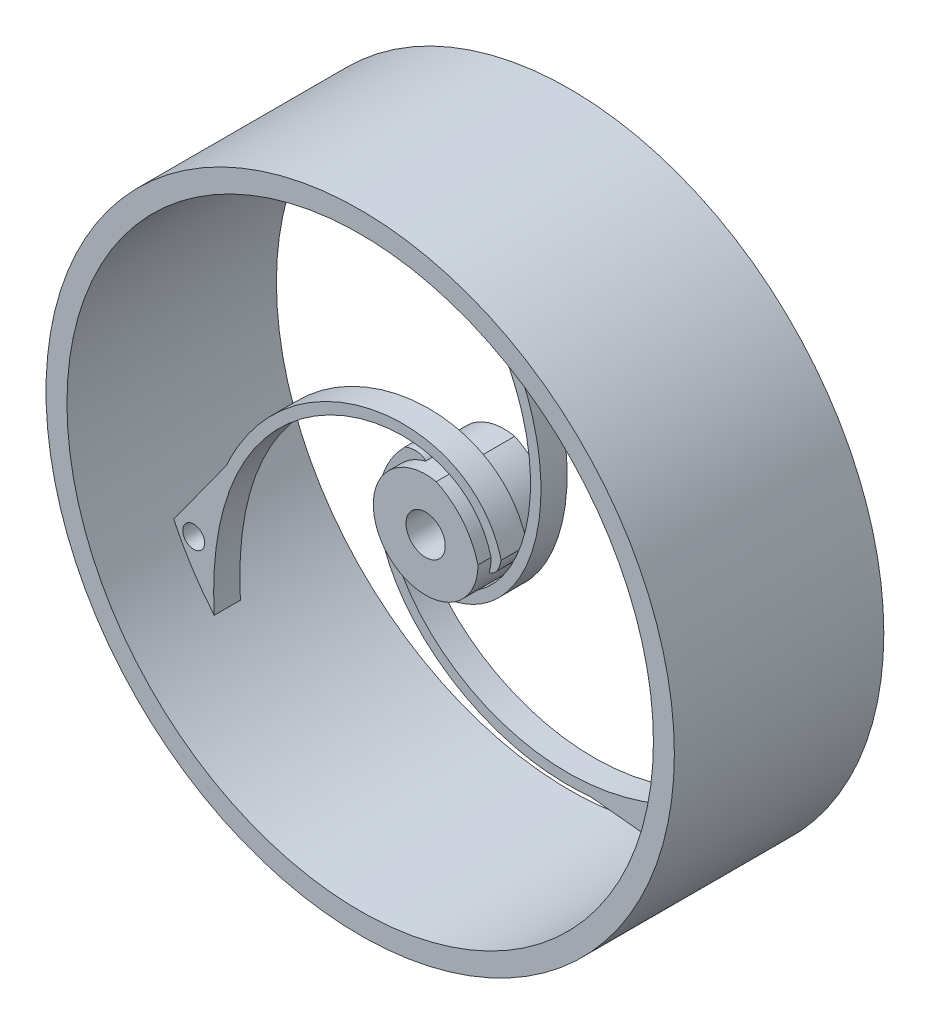
from build123d import *

# Parameters (mm, degrees)
SKETCH1_R            = 76.2
BOSS_EXTRUDE8_DEPTH  = 25.4
SKETCH1_3_R          = 2.652133243
BOSS_EXTRUDE9_DEPTH  = 6.35
SKETCH1_4_R          = 4.7625
BOSS_EXTRUDE10_DEPTH = 9.525
CIRPATTERN2_COUNT    = 3


with BuildPart() as part:
    # Sketch1 → Boss-Extrude8 (new, symmetric)
    with BuildSketch(Plane.XY):
        Circle(SKETCH1_R)
        with BuildLine():
            ThreePointArc((-64.2646615, -30.464859794), (-15.613322422, 69.385002435), (71.12, 0))
            ThreePointArc((71.12, 0), (24.341278866, -66.824819814), (-54.458080516, -45.74245147))
            ThreePointArc((-54.458080516, -45.74245147), (-55.813104666, -44.078926343), (-57.117332526, -42.375284367))
            ThreePointArc((-57.117332526, -42.375284367), (-60.982470201, -36.594982282), (-64.2646615, -30.464859794))
        make_face(mode=Mode.SUBTRACT)
    extrude(amount=BOSS_EXTRUDE8_DEPTH, both=True)

    # Sketch1<3> → Boss-Extrude9 (add)
    with BuildSketch(Plane.XY):
        with BuildLine():
            Line((-51.489686485, -12.770329882), (-64.2646615, -30.464859794))
            ThreePointArc((-64.2646615, -30.464859794), (-59.850844353, -38.417845205), (-54.458080516, -45.74245147))
            add(Edge.make_bspline(
                [(-54.458080516, -45.74245147), (-56.227173503, -12.770464941), (-42.479312579, 17.840425436), (5.439933994, 27.701840724), (12.7, 0)],
                knots=[0.164688389, 0.164688389, 0.164688389, 0.164688389, 0.164688389, 1.164688389, 1.164688389, 1.164688389, 1.164688389, 1.164688389], degree=4))
            ThreePointArc((12.7, 0), (12.581598046, -1.730141787), (12.228599905, -3.42802339))
            add(Edge.make_bspline(
                [(15.157020591, 0.643933082), (14.443060628, -2.918429068), (12.228599905, -3.42802339)],
                knots=[0, 0, 0, 0.719883781, 0.719883781, 0.719883781], degree=2))
            add(Edge.make_bspline(
                [(15.157020591, 0.643933082), (14.991425957, 1.275783561), (14.604911637, 2.54097033), (13.667954828, 4.887393309), (12.183192976, 7.556706342), (9.969654094, 10.294956422), (6.534622803, 13.326938907), (1.520056493, 15.963955949), (-5.168911286, 17.446899809), (-12.189081027, 17.436980233), (-21.635438647, 15.634364862), (-33.013454155, 10.343487809), (-43.696960831, 0.683796899), (-49.136108914, -7.765497225), (-51.219142397, -12.1715848), (-51.489686485, -12.770329882)],
                knots=[0, 0, 0, 0, 0.015625, 0.03125, 0.0625, 0.09375, 0.125, 0.1875, 0.25, 0.3125, 0.375, 0.5, 0.625, 0.725480641, 0.741105641, 0.741105641, 0.741105641, 0.741105641], degree=3))
        make_face()
        with Locations((-59.434967194, -31.713129844)):
            Circle(SKETCH1_3_R, mode=Mode.SUBTRACT)
    boss_extrude9 = extrude(amount=BOSS_EXTRUDE9_DEPTH)

    # Sketch1<4> → Boss-Extrude10 (add, symmetric)
    with BuildSketch(Plane.XY):
        with BuildLine():
            add(Edge.make_bspline(
                [(12.7, 0), (11.504351428, 4.56217151), (9.205933773, 8.105542424), (6.138994382, 10.705215229), (2.569011428, 12.437450715)],
                knots=[0, 0, 0, 0, 0, 0.164688389, 0.164688389, 0.164688389, 0.164688389, 0.164688389], degree=4))
            ThreePointArc((2.569011428, 12.437450715), (-10.847609987, -6.604495254), (12.228599905, -3.42802339))
            ThreePointArc((12.228599905, -3.42802339), (12.581598046, -1.730141787), (12.7, 0))
        make_face()
        Circle(SKETCH1_4_R, mode=Mode.SUBTRACT)
    extrude(amount=BOSS_EXTRUDE10_DEPTH, both=True)

    # CirPattern2: Boss-Extrude9 ×3 about axis
    cirpattern2_axis = Axis((0, 0, -27.94), (0, 0, 1))
    for i in range(1, CIRPATTERN2_COUNT):
        add(boss_extrude9.rotate(cirpattern2_axis, i * 360 / CIRPATTERN2_COUNT))


solid = part.part
